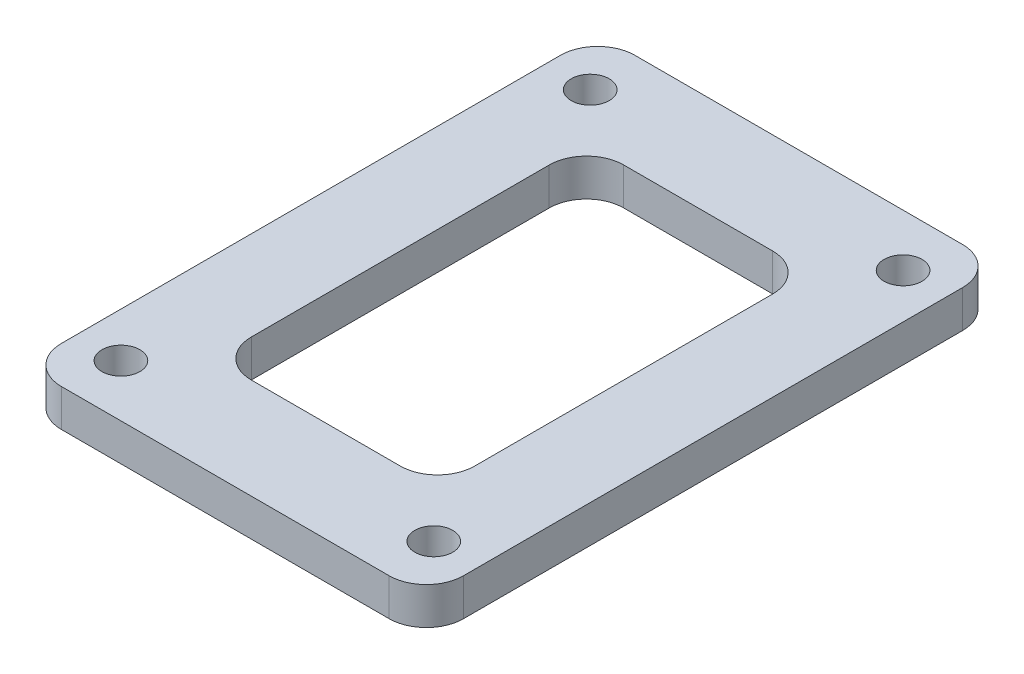
from build123d import *

# Parameters (mm, degrees)
SKETCH1_W            = 54
SKETCH1_H            = 77
BOSS_EXTRUDE1_DEPTH  = 5
SKETCH2_R            = 2.55
CUT_EXTRUDE1_DEPTH   = 48.289005065
LPATTERN1_COUNT      = 2
LPATTERN1_PITCH      = 42
LPATTERN1_COUNT_DIR2 = 2
LPATTERN1_PITCH_DIR2 = 63
SKETCH3_W            = 30
SKETCH3_H            = 50
CUT_EXTRUDE2_DEPTH   = 48.289005065
FILLET1_R            = 5


with BuildPart() as part:
    # Sketch1 → Boss-Extrude1 (new body)
    with BuildSketch(Plane(origin=(0, 0, 0), x_dir=(1, 0, 0), z_dir=(0, 1, 0))):
        Rectangle(SKETCH1_W, SKETCH1_H)
    extrude(amount=BOSS_EXTRUDE1_DEPTH)

    # Sketch2 → Cut-Extrude1 (cut, through all)
    with BuildSketch(Plane(origin=(0, 5, 0), x_dir=(1, 0, 0), z_dir=(0, 1, 0))):
        with Locations(Location((-21, 31.5, 0), (0, 0, 270))):
            Circle(SKETCH2_R)
    cut_extrude1 = extrude(amount=-CUT_EXTRUDE1_DEPTH, mode=Mode.SUBTRACT)

    # LPattern1: Cut-Extrude1 2 × 2
    with Locations(*[(i * LPATTERN1_PITCH, 0, j * LPATTERN1_PITCH_DIR2) for i in range(LPATTERN1_COUNT) for j in range(LPATTERN1_COUNT_DIR2) if (i, j) != (0, 0)]):
        add(cut_extrude1, mode=Mode.SUBTRACT)

    # Sketch3 → Cut-Extrude2 (cut, through all)
    with BuildSketch(Plane(origin=(0, 5, 0), x_dir=(1, 0, 0), z_dir=(0, 1, 0))):
        Rectangle(SKETCH3_W, SKETCH3_H)
    extrude(amount=-CUT_EXTRUDE2_DEPTH, mode=Mode.SUBTRACT)

    # Fillet1
    fillet1_edges = [part.edges().sort_by_distance(p)[0] for p in [
        (15, 2.5, -25),
        (15, 2.5, 25),
        (-15, 2.5, 25),
        (-15, 2.5, -25),
        (27, 2.5, 38.5),
        (-27, 2.5, 38.5),
        (-27, 2.5, -38.5),
        (27, 2.5, -38.5),
    ]]
    fillet(fillet1_edges, radius=FILLET1_R)


solid = part.part
